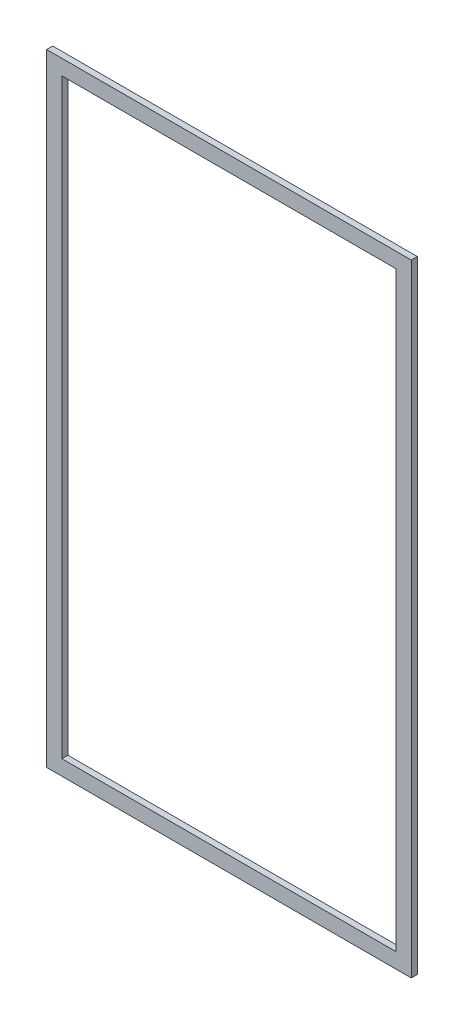
from build123d import *

# Parameters (mm, degrees)
SKETCH3_W           = 600
SKETCH3_H           = 1023
SKETCH3_W_2         = 550
SKETCH3_H_2         = 973
BOSS_EXTRUDE2_DEPTH = 10


with BuildPart() as part:
    # Sketch3 → Boss-Extrude2 (new body)
    with BuildSketch(Plane.XY):
        Rectangle(SKETCH3_W, SKETCH3_H)
        Rectangle(SKETCH3_W_2, SKETCH3_H_2, mode=Mode.SUBTRACT)
    extrude(amount=BOSS_EXTRUDE2_DEPTH)


solid = part.part
